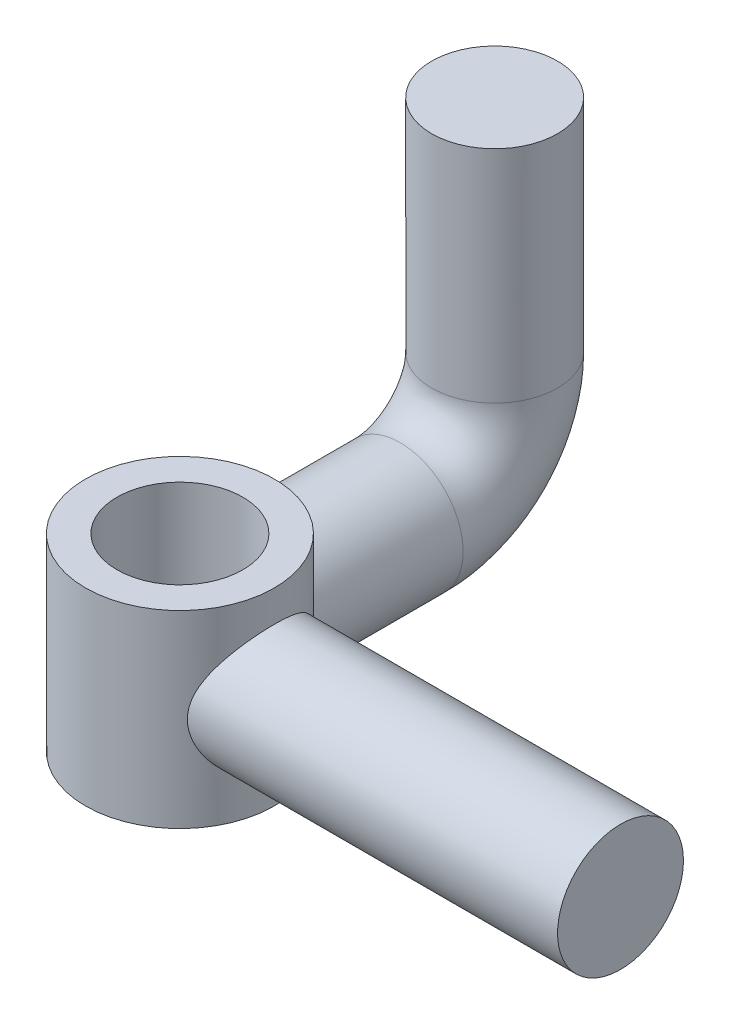
from build123d import *

# Parameters (mm, degrees)
SKETCH1_R                = 1.5
SKETCH1_R_2              = 1
BOSS_EXTRUDE1_DEPTH      = 3
SKETCH3_R                = 1
BOSS_EXTRUDE4_REACH      = 7.895
SKETCH4_R                = 1
BOSS_EXTRUDE5_REACH      = 12.977
BOSS_EXTRUDE5_END_RADIUS = 1.5
SKETCH6_R                = 1


with BuildPart() as part:
    # Sketch1 → Boss-Extrude1 (new body)
    with BuildSketch(Plane(origin=(0, 0, 0), x_dir=(1, 0, 0), z_dir=(0, 1, 0))):
        with Locations(Location((0, 0, 0), (0, 0, 270))):
            Circle(SKETCH1_R)
        with Locations(Location((0, 0, 0), (0, 0, 270))):
            Circle(SKETCH1_R_2, mode=Mode.SUBTRACT)
    extrude(amount=-BOSS_EXTRUDE1_DEPTH)

    # Sketch4 → Boss-Extrude4 (add, up to next)
    with BuildSketch(Plane.XY.offset(-1.5), mode=Mode.PRIVATE) as boss_extrude4_sk1:
        with Locations(Location((0, -1.5, 0), (0, 0, 180))):
            Circle(SKETCH4_R)
    boss_extrude4_tool1 = extrude(boss_extrude4_sk1.sketch, amount=BOSS_EXTRUDE4_REACH, mode=Mode.PRIVATE) - part.part


with BuildPart() as body_2:
    # Sweep1: sweep along a path in Sketch2
    with BuildLine(Plane(origin=(0, 0, 0), x_dir=(0, 0, -1), z_dir=(1, 0, 0))) as sweep1_path:
        Line((1.5, -1.5), (3.5, -1.5))
        ThreePointArc((3.5, -1.5), (4.560660172, -1.060660172), (5, 0))
        Line((5, 0), (5, 3.5))
    # Sketch3 → Sweep1 (sweep)
    with BuildSketch(Plane(origin=(0, 3.5, 0), x_dir=(1, 0, 0), z_dir=(0, 1, 0))):
        with Locations((0, 5)):
            Circle(SKETCH3_R)
    sweep(path=sweep1_path.line)


with BuildPart() as part_1:
    add(part.part)

    add(body_2.part)  # Boss-Extrude4 merges body 2
    add(boss_extrude4_tool1.solids().sort_by_distance((0, -1.5, -1.5))[0])
    add(boss_extrude4_tool1.solids().sort_by_distance((0, -1.5, -1.5))[1])

    # Boss-Extrude5: up to this cylinder (the profile starts outside it)
    boss_extrude5_end = Plane(origin=(0, -1.5, 0), z_dir=(0, 1, 0)) * Cylinder(BOSS_EXTRUDE5_END_RADIUS, 29.954, mode=Mode.PRIVATE)
    # Sketch6 → Boss-Extrude5 (add, up to the surface)
    with BuildSketch(Plane(origin=(7, 0, 0), x_dir=(0, 0, -1), z_dir=(1, 0, 0)), mode=Mode.PRIVATE) as boss_extrude5_sk1:
        with Locations((0, -1.5)):
            Circle(SKETCH6_R)
    boss_extrude5_tool1 = extrude(boss_extrude5_sk1.sketch, amount=-BOSS_EXTRUDE5_REACH, mode=Mode.PRIVATE) - boss_extrude5_end
    add(boss_extrude5_tool1.solids().sort_by_distance((7, -1.5, 0))[0])


solid = part_1.part
